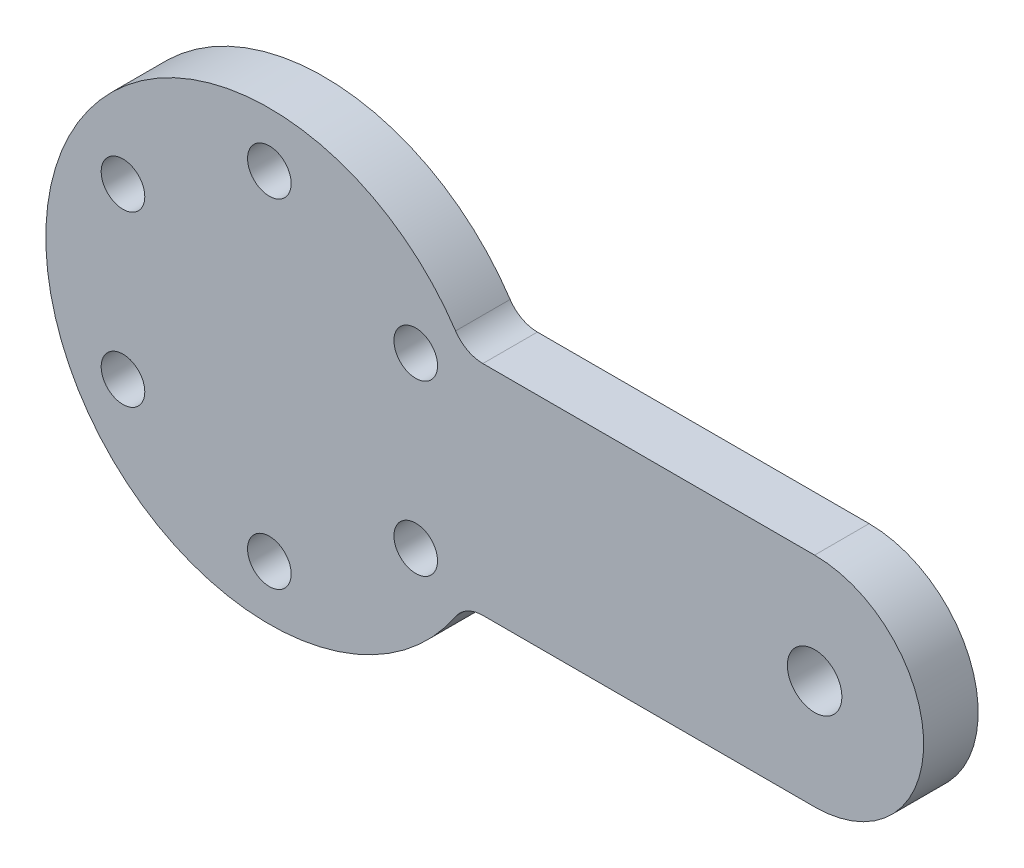
from build123d import *

# Parameters (mm, degrees)
SKETCH_1_R               = 2.5
EXTRUDE_1_DEPTH          = 2.5
CUT_EXTRUDE_1_REACH      = 65.602
SKETCH_2_R               = 2
PATTERN_CIRCULAR_1_COUNT = 6
FILLET_1_R               = 3


with BuildPart() as part:
    # 草圖1 → 填料-伸長1 (new, symmetric)
    with BuildSketch(Plane.XY):
        with BuildLine():
            Line((17.895530168, 10), (50, 10))
            ThreePointArc((50, 10), (60, 0), (50, -10))
            Line((50, -10), (17.895530168, -10))
            ThreePointArc((17.895530168, -10), (-20.5, 0), (17.895530168, 10))
        make_face()
        with Locations((50, 0)):
            Circle(SKETCH_1_R, mode=Mode.SUBTRACT)
    extrude(amount=EXTRUDE_1_DEPTH, both=True)

    # 草圖2 → 除料-伸長1 (cut, up to next)
    with BuildSketch(Plane.XY.offset(2.5), mode=Mode.PRIVATE) as cut_extrude_1_sk1:
        with Locations((0, 15.5)):
            Circle(SKETCH_2_R)
    cut_extrude_1_tool1 = extrude(cut_extrude_1_sk1.sketch, amount=-CUT_EXTRUDE_1_REACH, mode=Mode.PRIVATE) & part.part
    cut_extrude_1 = cut_extrude_1_tool1.solids().sort_by_distance((0, 15.5, 2.5))[0]
    add(cut_extrude_1, mode=Mode.SUBTRACT)

    # 環狀複製排列1: 除料-伸長1 ×6 about axis
    pattern_circular_1_axis = Axis((0, 0, 0), (0, 0, 1))
    for i in range(1, PATTERN_CIRCULAR_1_COUNT):
        add(cut_extrude_1.rotate(pattern_circular_1_axis, i * 360 / PATTERN_CIRCULAR_1_COUNT), mode=Mode.SUBTRACT)

    # 圓角1
    fillet_1_edges = [part.edges().sort_by_distance(p)[0] for p in [
        (17.895530168, 10, 0),
        (17.895530168, -10, 0),
    ]]
    fillet(fillet_1_edges, radius=FILLET_1_R)


solid = part.part
